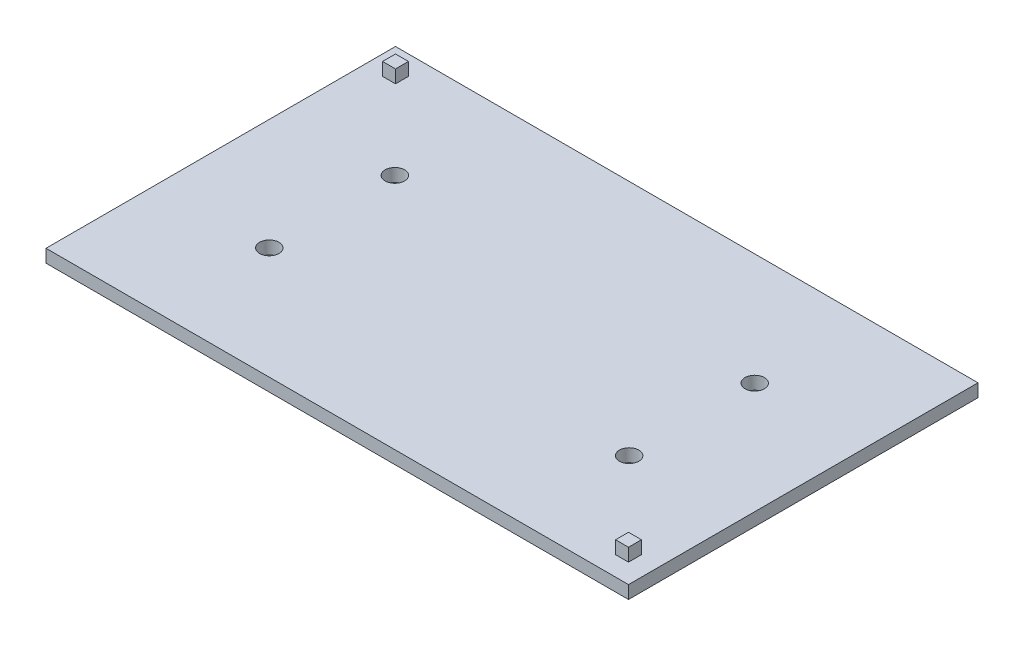
from build123d import *

# Parameters (mm, degrees)
SKETCH2_W           = 90
SKETCH2_H           = 54
SKETCH2_R           = 1.5
BOSS_EXTRUDE1_DEPTH = 2
SKETCH2_4_W         = 2
SKETCH2_4_H         = 2
BOSS_EXTRUDE3_DEPTH = 4


with BuildPart() as part:
    # Sketch2 → Boss-Extrude1 (new body)
    with BuildSketch(Plane(origin=(0, 1, 0), x_dir=(1, 0, 0), z_dir=(0, 1, 0))):
        Rectangle(SKETCH2_W, SKETCH2_H)
        with Locations((-27.8, 9.7)):
            Circle(SKETCH2_R, mode=Mode.SUBTRACT)
        with Locations((-27.8, -9.7)):
            Circle(SKETCH2_R, mode=Mode.SUBTRACT)
        with Locations((27.8, -9.7)):
            Circle(SKETCH2_R, mode=Mode.SUBTRACT)
        with Locations((27.8, 9.7)):
            Circle(SKETCH2_R, mode=Mode.SUBTRACT)
    extrude(amount=BOSS_EXTRUDE1_DEPTH)

    # Sketch2<4> → Boss-Extrude3 (add)
    with BuildSketch(Plane(origin=(0, 1, 0), x_dir=(1, 0, 0), z_dir=(0, 1, 0))):
        with Locations((41, -23)):
            Rectangle(SKETCH2_4_W, SKETCH2_4_H)
        with Locations((-41, 23)):
            Rectangle(SKETCH2_4_W, SKETCH2_4_H)
    extrude(amount=BOSS_EXTRUDE3_DEPTH)


solid = part.part
